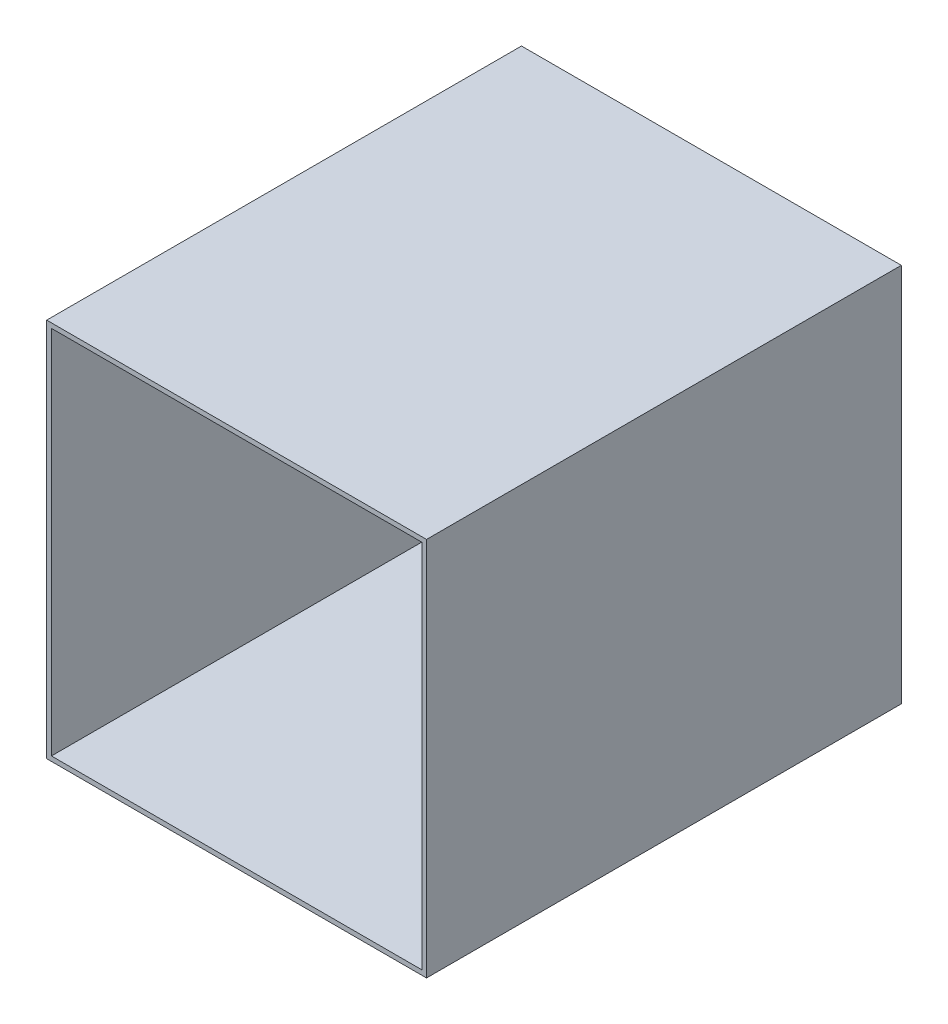
from build123d import *

# Parameters (mm, degrees)
SKETCH1_W           = 0.08
SKETCH1_H           = 0.08
BOSS_EXTRUDE1_DEPTH = 0.1
SHELL1_T            = -0.001


with BuildPart() as part:
    # Sketch1 → Boss-Extrude1 (new body)
    with BuildSketch(Plane.XY):
        Rectangle(SKETCH1_W, SKETCH1_H)
    extrude(amount=BOSS_EXTRUDE1_DEPTH)

    # Shell1
    shell1_openings = [part.faces().sort_by_distance(p)[0] for p in [
        (0, 0, 0.1),
    ]]
    offset(amount=SHELL1_T, openings=shell1_openings, kind=Kind.INTERSECTION)


solid = part.part
